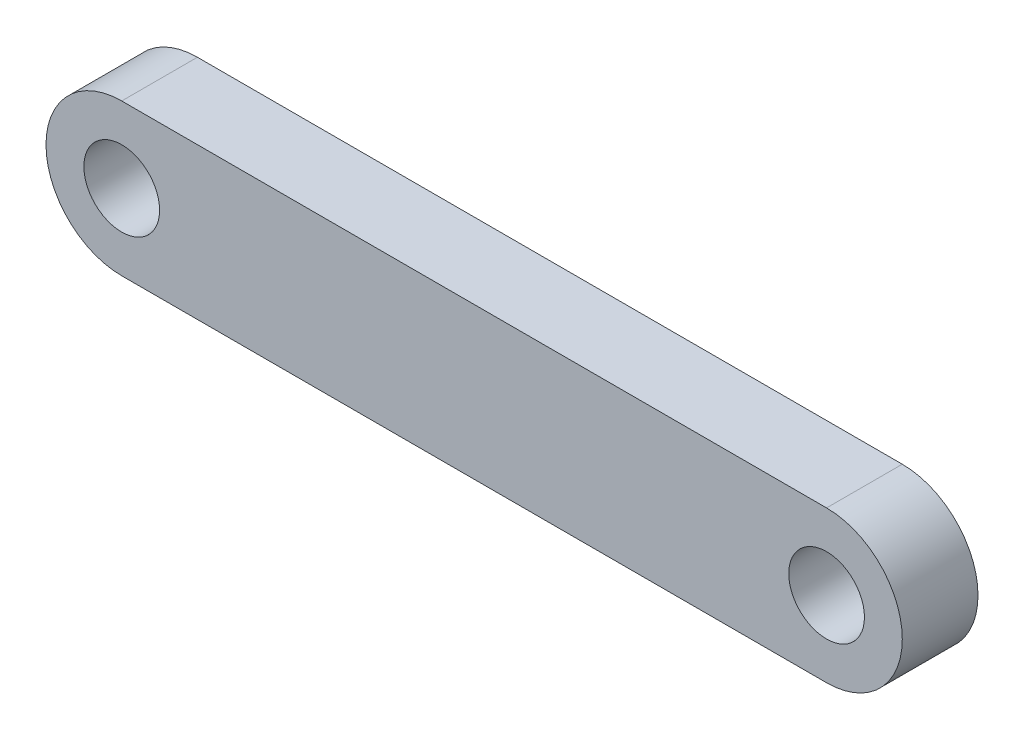
from build123d import *

# Parameters (mm, degrees)
SKETCH1_R           = 1
BOSS_EXTRUDE1_DEPTH = 2


with BuildPart() as part:
    # Sketch1 → Boss-Extrude1 (new body)
    with BuildSketch(Plane.XY):
        with BuildLine():
            Line((0, 2), (18.62, 2))
            ThreePointArc((18.62, 2), (20.62, 0), (18.62, -2))
            Line((18.62, -2), (0, -2))
            ThreePointArc((0, -2), (-2, 0), (0, 2))
        make_face()
        Circle(SKETCH1_R, mode=Mode.SUBTRACT)
        with Locations((18.62, 0)):
            Circle(SKETCH1_R, mode=Mode.SUBTRACT)
    extrude(amount=BOSS_EXTRUDE1_DEPTH)


solid = part.part
